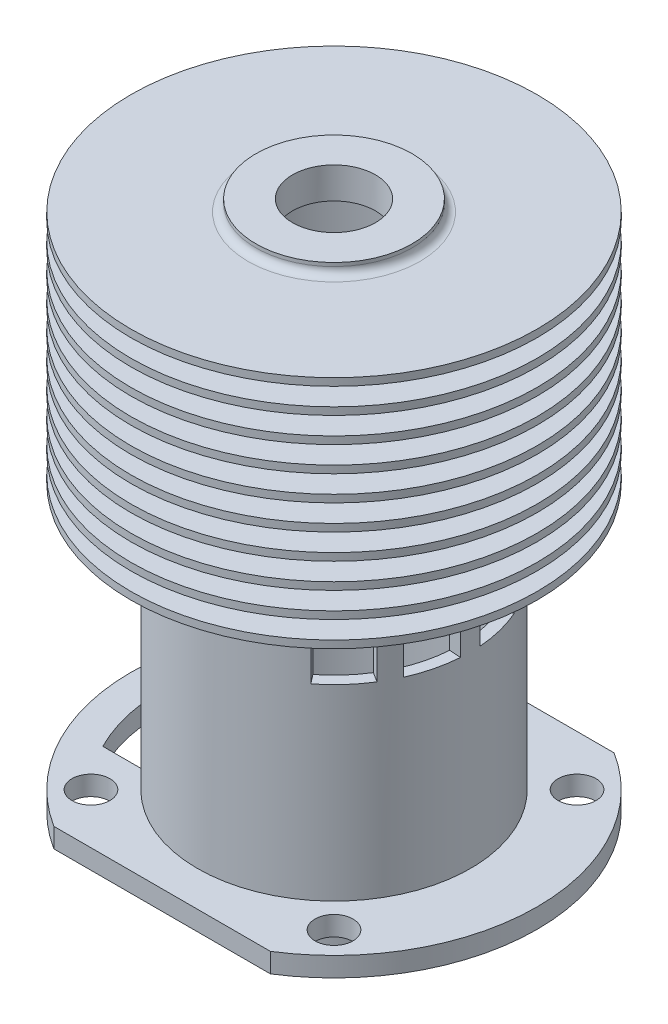
from build123d import *

# Parameters (mm, degrees)
F_3_8_24_TAPPED_HOLE1_D         = 8.4328
CUT_EXTRUDE1_DEPTH              = 6.35
CUT_EXTRUDE2_DEPTH              = 4.7625
F_24_0_152_DIAMETER_HOLE1_D     = 3.8608
F_24_0_152_DIAMETER_HOLE1_DEPTH = 1.984375
CUT_EXTRUDE3_REACH              = 63.361
CUT_EXTRUDE4_REACH              = 63.361


with BuildPart() as part:
    # Sketch1 → Revolve1 (revolve)
    with BuildSketch(Plane.XY, mode=Mode.PRIVATE) as revolve1_sk:
        with BuildLine():
            Line((13.8811, 0), (13.8811, 2.778125))
            Line((13.8811, 2.778125), (20.6375, 2.778125))
            Line((20.6375, 2.778125), (20.6375, 4.7625))
            Line((20.6375, 4.7625), (13.8811, 4.7625))
            Line((13.8811, 4.7625), (13.8811, 31.75))
            Line((13.8811, 31.75), (20.6375, 31.75))
            Line((20.6375, 31.75), (20.6375, 32.512))
            Line((20.6375, 32.512), (13.8811, 32.512))
            Line((13.8811, 32.512), (13.8811, 34.3154))
            Line((13.8811, 34.3154), (20.6375, 34.3154))
            Line((20.6375, 34.3154), (20.6375, 35.0774))
            Line((20.6375, 35.0774), (13.8811, 35.0774))
            Line((13.8811, 35.0774), (13.8811, 36.8808))
            Line((13.8811, 36.8808), (20.6375, 36.8808))
            Line((20.6375, 36.8808), (20.6375, 37.6428))
            Line((20.6375, 37.6428), (13.8811, 37.6428))
            Line((13.8811, 37.6428), (13.8811, 39.4462))
            Line((13.8811, 39.4462), (20.6375, 39.4462))
            Line((20.6375, 39.4462), (20.6375, 40.2082))
            Line((20.6375, 40.2082), (13.8811, 40.2082))
            Line((13.8811, 40.2082), (13.8811, 42.0116))
            Line((13.8811, 42.0116), (20.6375, 42.0116))
            Line((20.6375, 42.0116), (20.6375, 42.7736))
            Line((20.6375, 42.7736), (13.8811, 42.7736))
            Line((13.8811, 42.7736), (13.8811, 44.577))
            Line((13.8811, 44.577), (20.6375, 44.577))
            Line((20.6375, 44.577), (20.6375, 45.339))
            Line((20.6375, 45.339), (13.8811, 45.339))
            Line((13.8811, 45.339), (13.8811, 47.1424))
            Line((13.8811, 47.1424), (20.6375, 47.1424))
            Line((20.6375, 47.1424), (20.6375, 47.9044))
            Line((20.6375, 47.9044), (13.8811, 47.9044))
            Line((13.8811, 47.9044), (13.8811, 49.7078))
            Line((13.8811, 49.7078), (20.6375, 49.7078))
            Line((20.6375, 49.7078), (20.6375, 50.4698))
            Line((20.6375, 50.4698), (13.8811, 50.4698))
            Line((13.8811, 50.4698), (13.8811, 52.2732))
            Line((13.8811, 52.2732), (20.6375, 52.2732))
            Line((20.6375, 52.2732), (20.6375, 53.0352))
            Line((20.6375, 53.0352), (13.8811, 53.0352))
            Line((13.8811, 53.0352), (13.8811, 54.8386))
            Line((13.8811, 54.8386), (20.6375, 54.8386))
            Line((20.6375, 54.8386), (20.6375, 55.6006))
            Line((20.6375, 55.6006), (13.8811, 55.6006))
            Line((13.8811, 55.6006), (8.73125, 55.6006))
            ThreePointArc((8.73125, 55.6006), (8.169983992, 55.833083992), (7.9375, 56.39435))
            Line((7.9375, 56.39435), (7.9375, 56.753125))
            Line((7.9375, 56.753125), (0, 56.753125))
            Line((0, 56.753125), (0, 53.578125))
            Line((0, 53.578125), (12.7, 53.578125))
            Line((12.7, 53.578125), (12.7, 0))
            Line((12.7, 0), (13.8811, 0))
        make_face()
    revolve(revolve1_sk.sketch.rotate(Axis((0, 0, 0), (0, 1, 0)), 90), axis=Axis((0, 0, 0), (0, 1, 0)))

    # 3/8-24 Tapped Hole1 (through all)
    with Locations(Plane(origin=(0, 56.753125, 0), x_dir=(1, 0, 0), z_dir=(0, 1, 0))):
        with Locations((0, 0)):
            Hole(F_3_8_24_TAPPED_HOLE1_D / 2)

    # Sketch4 → Cut-Extrude1 (cut)
    with BuildSketch(Plane(origin=(0, 30.159325, 0), x_dir=(-1, 0, 0), z_dir=(0, -1, 0))):
        with BuildLine():
            Line((-7.840239437, 9.991028254), (-8.569381705, 10.920193881))
            ThreePointArc((-8.569381705, 10.920193881), (-10.315667637, 9.28826886), (-11.756116218, 7.38096665))
            Line((-11.756116218, 7.38096665), (-10.755824536, 6.752942955))
            ThreePointArc((-10.755824536, 6.752942955), (-9.437939284, 8.4979587), (-7.840239437, 9.991028254))
        make_face()
        with BuildLine():
            ThreePointArc((-11.756116218, -7.38096665), (-10.315667637, -9.28826886), (-8.569381705, -10.920193881))
            Line((-8.569381705, -10.920193881), (-7.840239437, -9.991028254))
            ThreePointArc((-7.840239437, -9.991028254), (-9.437939284, -8.4979587), (-10.755824536, -6.752942955))
            Line((-10.755824536, -6.752942955), (-11.756116218, -7.38096665))
        make_face()
        with BuildLine():
            ThreePointArc((-13.845188464, -0.997844484), (-13.468772006, -3.358142025), (-12.693035436, -5.61887788))
            Line((-12.693035436, -5.61887788), (-11.613024187, -5.140784886))
            ThreePointArc((-11.613024187, -5.140784886), (-12.322755724, -3.072408074), (-12.667144066, -0.912940973))
            Line((-12.667144066, -0.912940973), (-13.845188464, -0.997844484))
        make_face()
        with BuildLine():
            ThreePointArc((-12.693035436, 5.61887788), (-13.468772006, 3.358142025), (-13.845188464, 0.997844484))
            Line((-13.845188464, 0.997844484), (-12.667144066, 0.912940973))
            ThreePointArc((-12.667144066, 0.912940973), (-12.322755724, 3.072408074), (-11.613024187, 5.140784886))
            Line((-11.613024187, 5.140784886), (-12.693035436, 5.61887788))
        make_face()
    extrude(amount=CUT_EXTRUDE1_DEPTH, mode=Mode.SUBTRACT)

    # Sketch4<3> → Cut-Extrude2 (cut)
    with BuildSketch(Plane(origin=(0, 30.159325, 0), x_dir=(-1, 0, 0), z_dir=(0, -1, 0))):
        with BuildLine():
            Line((13.218001272, 4.2390305), (12.093322298, 3.878344465))
            ThreePointArc((12.093322298, 3.878344465), (11.414684388, 5.567313564), (10.501569792, 7.141920743))
            Line((10.501569792, 7.141920743), (11.478215783, 7.806119372))
            ThreePointArc((11.478215783, 7.806119372), (12.476250036, 6.085073726), (13.218001272, 4.2390305))
        make_face()
        with BuildLine():
            Line((13.738529509, -1.984375), (12.569560392, -1.81553065))
            ThreePointArc((12.569560392, -1.81553065), (12.7, 0), (12.569560392, 1.81553065))
            Line((12.569560392, 1.81553065), (13.738529509, 1.984375))
            ThreePointArc((13.738529509, 1.984375), (13.8811, 0), (13.738529509, -1.984375))
        make_face()
        with BuildLine():
            Line((11.478215783, -7.806119372), (10.501569792, -7.141920743))
            ThreePointArc((10.501569792, -7.141920743), (11.414684388, -5.567313564), (12.093322298, -3.878344465))
            Line((12.093322298, -3.878344465), (13.218001272, -4.2390305))
            ThreePointArc((13.218001272, -4.2390305), (12.476250036, -6.085073726), (11.478215783, -7.806119372))
        make_face()
    extrude(amount=CUT_EXTRUDE2_DEPTH, mode=Mode.SUBTRACT)

    # #24 (0.152) Diameter Hole1
    with Locations(Plane.XZ.offset(-2.778125)):
        with Locations((-12.347852166, 12.347852166), (12.347852166, 12.347852166), (12.347852166, -12.347852166), (-12.347852166, -12.347852166)):
            Hole(F_24_0_152_DIAMETER_HOLE1_D / 2, depth=F_24_0_152_DIAMETER_HOLE1_DEPTH)

    # Sketch5<2> → Cut-Extrude3 (cut, up to next)
    with BuildSketch(Plane.XZ.offset(-2.778125), mode=Mode.PRIVATE) as cut_extrude3_sk1:
        with BuildLine():
            Line((-10.998522628, 17.4625), (10.998522628, 17.4625))
            ThreePointArc((10.998522628, 17.4625), (0, 20.6375), (-10.998522628, 17.4625))
        make_face()
    cut_extrude3_tool1 = extrude(cut_extrude3_sk1.sketch, amount=-CUT_EXTRUDE3_REACH, mode=Mode.PRIVATE) & part.part
    # Sketch5<2> → Cut-Extrude3 (cut, up to next)
    with BuildSketch(Plane.XZ.offset(-2.778125), mode=Mode.PRIVATE) as cut_extrude3_sk2:
        with BuildLine():
            Line((-10.998522628, -17.4625), (10.998522628, -17.4625))
            ThreePointArc((10.998522628, -17.4625), (0, -20.6375), (-10.998522628, -17.4625))
        make_face()
    cut_extrude3_tool2 = extrude(cut_extrude3_sk2.sketch, amount=-CUT_EXTRUDE3_REACH, mode=Mode.PRIVATE) & part.part
    add(cut_extrude3_tool1.solids().sort_by_distance((0, 2.778125, 18.741265))[0], mode=Mode.SUBTRACT)
    add(cut_extrude3_tool2.solids().sort_by_distance((0, 2.778125, -18.741265))[0], mode=Mode.SUBTRACT)

    # Sketch9 → Cut-Extrude4 (cut, up to next)
    with BuildSketch(Plane.XZ.offset(-2.778125), mode=Mode.PRIVATE) as cut_extrude4_sk1:
        with BuildLine():
            Line((-11.387757943, -7.9375), (-15.554259867, -7.9375))
            ThreePointArc((-15.554259867, -7.9375), (-17.4625, 0), (-15.554259867, 7.9375))
            Line((-15.554259867, 7.9375), (-11.387757943, 7.9375))
            ThreePointArc((-11.387757943, 7.9375), (-13.8811, 0), (-11.387757943, -7.9375))
        make_face()
    cut_extrude4_tool1 = extrude(cut_extrude4_sk1.sketch, amount=-CUT_EXTRUDE4_REACH, mode=Mode.PRIVATE) & part.part
    add(cut_extrude4_tool1.solids().sort_by_distance((-14.932693, 2.778125, 0))[0], mode=Mode.SUBTRACT)


solid = part.part
